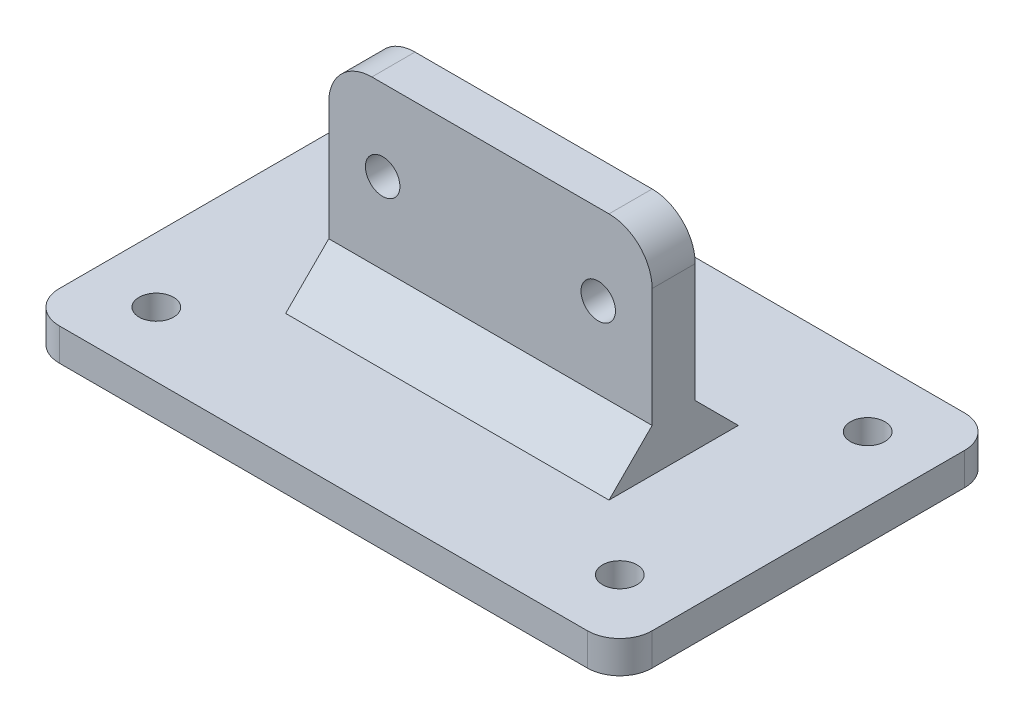
from build123d import *

# Parameters (mm, degrees)
SKETCH_1_W          = 55
SKETCH_1_H          = 35
EXTRUDE_1_DEPTH     = 3
SKETCH_2_R          = 1.6
CUT_EXTRUDE_1_DEPTH = 3
FILLET_1_R          = 3
SKETCH_3_W          = 30
SKETCH_3_H          = 4
EXTRUDE_2_DEPTH     = 19
CHAMFER_1_SIZE      = 4
SKETCH_4_R          = 1.6
CUT_EXTRUDE_2_DEPTH = 19
FILLET_3_R          = 4


with BuildPart() as part:
    # 草图1 → 凸台-拉伸1 (new body)
    with BuildSketch(Plane(origin=(0, 0, 0), x_dir=(1, 0, 0), z_dir=(0, 1, 0))):
        with Locations((27.5, 17.5)):
            Rectangle(SKETCH_1_W, SKETCH_1_H)
    extrude(amount=EXTRUDE_1_DEPTH)

    # 草图2 → 切除-拉伸1 (cut)
    with BuildSketch(Plane(origin=(0, 3, 0), x_dir=(1, 0, 0), z_dir=(0, 1, 0))):
        with Locations(Location((6, 29, 0), (0, 0, 270))):
            Circle(SKETCH_2_R)
        with Locations(Location((49, 29, 0), (0, 0, 270))):
            Circle(SKETCH_2_R)
        with Locations(Location((49, 6, 0), (0, 0, 270))):
            Circle(SKETCH_2_R)
        with Locations(Location((6, 6, 0), (0, 0, 270))):
            Circle(SKETCH_2_R)
    extrude(amount=-CUT_EXTRUDE_1_DEPTH, mode=Mode.SUBTRACT)

    # 圆角1
    fillet_1_edges = [part.edges().sort_by_distance(p)[0] for p in [
        (0, 1.5, -35),
        (55, 1.5, -35),
        (55, 1.5, 0),
        (0, 1.5, 0),
    ]]
    fillet(fillet_1_edges, radius=FILLET_1_R)

    # 草图3 → 凸台-拉伸2 (add)
    with BuildSketch(Plane(origin=(0, 3, 0), x_dir=(1, 0, 0), z_dir=(0, 1, 0))):
        with Locations((27.5, 17.5)):
            Rectangle(SKETCH_3_W, SKETCH_3_H)
    extrude(amount=EXTRUDE_2_DEPTH)

    # 倒角1
    chamfer_1_edges = [part.edges().sort_by_distance(p)[0] for p in [
        (27.5, 3, -15.5),
        (27.5, 3, -19.5),
    ]]
    chamfer(chamfer_1_edges, length=CHAMFER_1_SIZE)

    # 草图4 → 切除-拉伸2 (cut)
    with BuildSketch(Plane(origin=(0, 0, -19.5), x_dir=(-1, 0, 0), z_dir=(0, 0, -1))):
        with Locations((-37.5, 14.5)):
            Circle(SKETCH_4_R)
        with Locations((-17.5, 14.5)):
            Circle(SKETCH_4_R)
    extrude(amount=-CUT_EXTRUDE_2_DEPTH, mode=Mode.SUBTRACT)

    # 圆角3
    fillet_3_edges = [part.edges().sort_by_distance(p)[0] for p in [
        (12.5, 22, -17.5),
        (42.5, 22, -17.5),
    ]]
    fillet(fillet_3_edges, radius=FILLET_3_R)


solid = part.part
